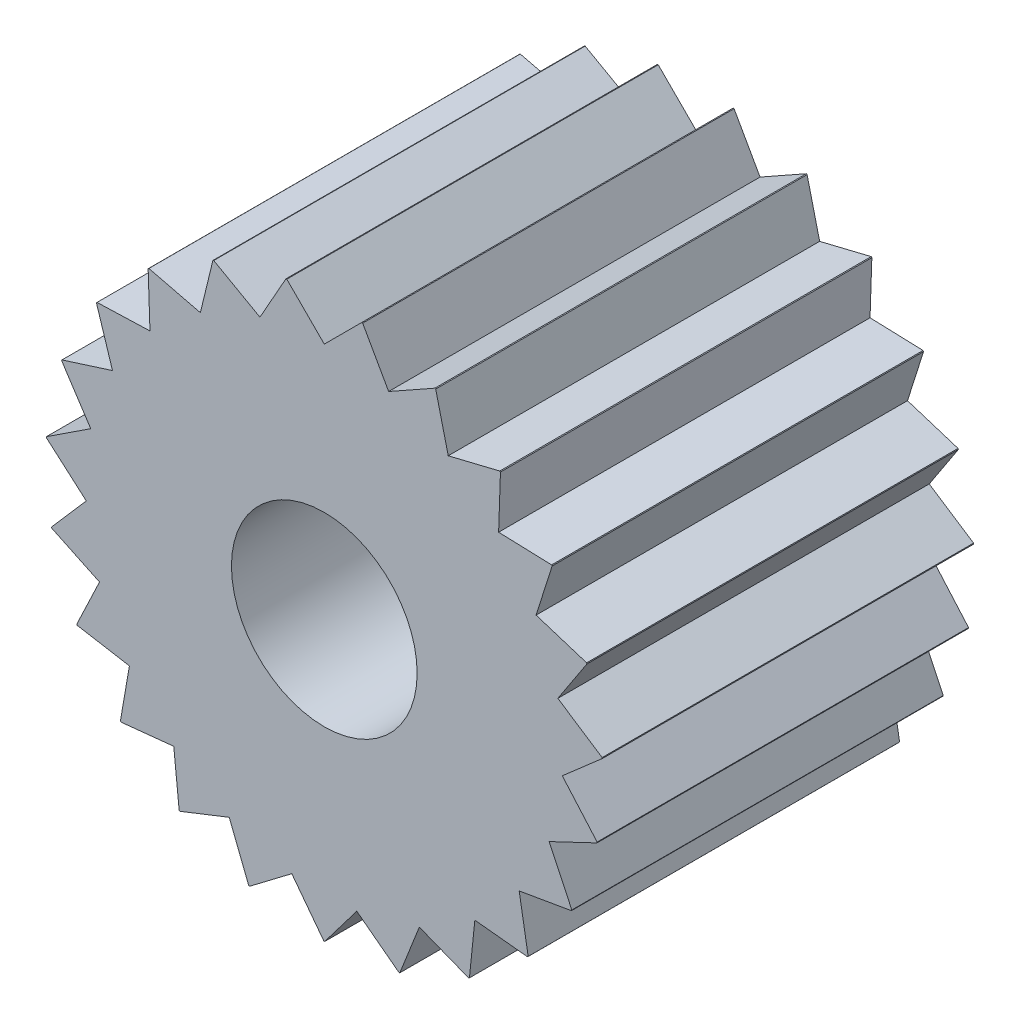
from build123d import *

# Parameters (mm, degrees)
SKETCH1_R           = 3.75
SKETCH1_R_2         = 1.25
BOSS_EXTRUDE1_DEPTH = 5
CUT_EXTRUDE1_DEPTH  = 8.288689869
CIRPATTERN1_COUNT   = 23


with BuildPart() as part:
    # Sketch1 → Boss-Extrude1 (new body)
    with BuildSketch(Plane.XY):
        Circle(SKETCH1_R)
        Circle(SKETCH1_R_2, mode=Mode.SUBTRACT)
    extrude(amount=BOSS_EXTRUDE1_DEPTH)

    # Sketch2 → Cut-Extrude1 (cut, through all)
    with BuildSketch(Plane.XY):
        Polygon((0, 3.211260138), (1.027348171, 4.238608309), (-1.027348171, 4.238608309), align=None)
    cut_extrude1 = extrude(amount=CUT_EXTRUDE1_DEPTH, mode=Mode.SUBTRACT)

    # CirPattern1: Cut-Extrude1 ×23 about axis
    cirpattern1_axis = Axis((0, 0, 0), (0, 0, 1))
    for i in range(1, CIRPATTERN1_COUNT):
        add(cut_extrude1.rotate(cirpattern1_axis, i * 360 / CIRPATTERN1_COUNT), mode=Mode.SUBTRACT)


solid = part.part
